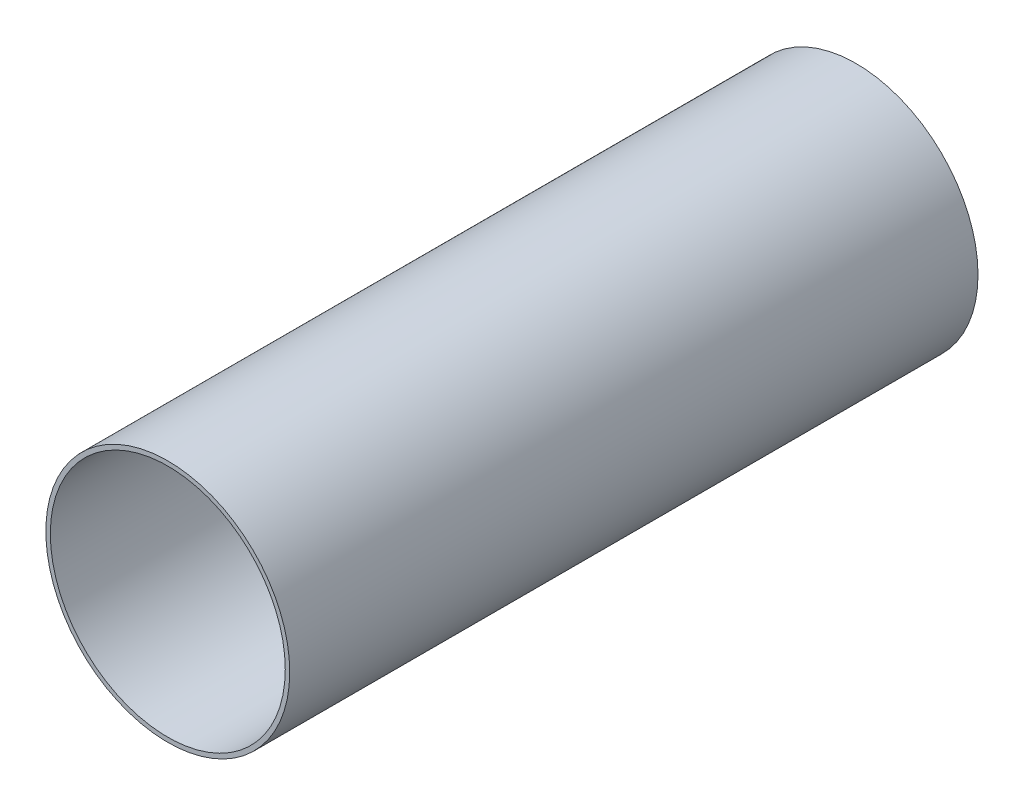
from build123d import *

# Parameters (mm, degrees)
SKETCH1_R           = 49.5046
SKETCH1_R_2         = 47.6885
BOSS_EXTRUDE1_DEPTH = 279.4


with BuildPart() as part:
    # Sketch1 → Boss-Extrude1 (new body)
    with BuildSketch(Plane.XY):
        Circle(SKETCH1_R)
        Circle(SKETCH1_R_2, mode=Mode.SUBTRACT)
    extrude(amount=BOSS_EXTRUDE1_DEPTH)


solid = part.part
